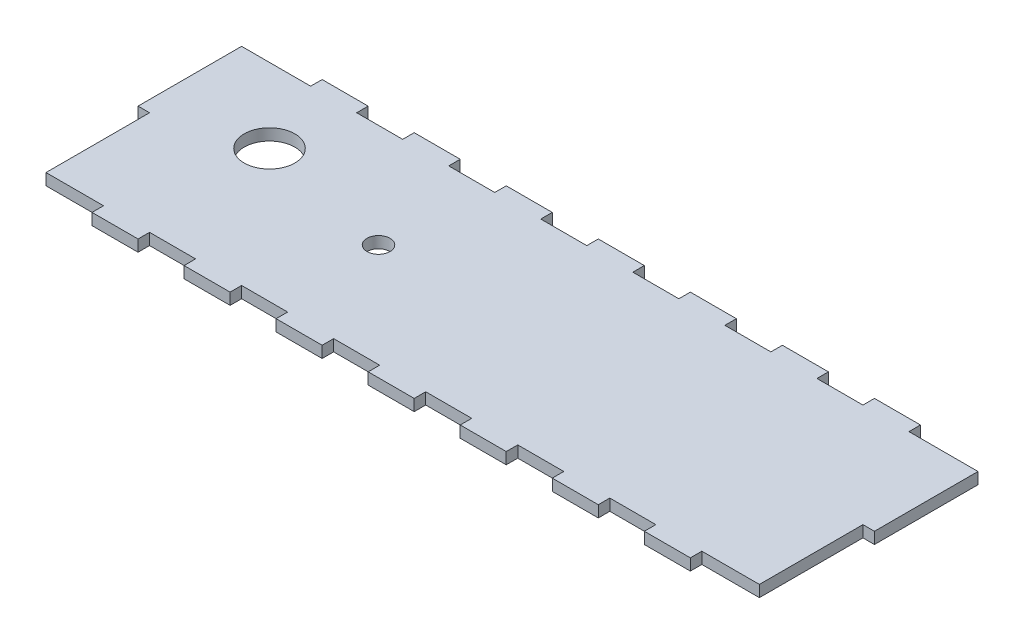
from build123d import *

# Parameters (mm, degrees)
SKETCH1_W           = 160
SKETCH1_H           = 50
BOSS_EXTRUDE1_DEPTH = 1.25
SKETCH2_W           = 10
SKETCH2_H           = 2.5
SKETCH2_W_2         = 15
CUT_EXTRUDE1_DEPTH  = 4
SKETCH3_W           = 2.5
SKETCH3_H           = 22.5
CUT_EXTRUDE2_DEPTH  = 84.852549156
CUT_EXTRUDE4_REACH  = 85.853
SKETCH4_R           = 5.5
SKETCH4_R_2         = 2.5


with BuildPart() as part:
    # Sketch1 → Boss-Extrude1 (new, symmetric)
    with BuildSketch(Plane(origin=(0, 0, 0), x_dir=(1, 0, 0), z_dir=(0, 1, 0))):
        Rectangle(SKETCH1_W, SKETCH1_H)
    extrude(amount=BOSS_EXTRUDE1_DEPTH, both=True)

    # Sketch2 → Cut-Extrude1 (cut)
    with BuildSketch(Plane(origin=(0, 1.25, 0), x_dir=(1, 0, 0), z_dir=(0, 1, 0))):
        with Locations((30, 23.75)):
            Rectangle(SKETCH2_W, SKETCH2_H)
        with Locations((10, 23.75)):
            Rectangle(SKETCH2_W, SKETCH2_H)
        with Locations((10, -23.75)):
            Rectangle(SKETCH2_W, SKETCH2_H)
        with Locations((30, -23.75)):
            Rectangle(SKETCH2_W, SKETCH2_H)
        with Locations((50, 23.75)):
            Rectangle(SKETCH2_W, SKETCH2_H)
        with Locations((50, -23.75)):
            Rectangle(SKETCH2_W, SKETCH2_H)
        with Locations((-10, 23.75)):
            Rectangle(SKETCH2_W, SKETCH2_H)
        with Locations((-10, -23.75)):
            Rectangle(SKETCH2_W, SKETCH2_H)
        with Locations((-30, 23.75)):
            Rectangle(SKETCH2_W, SKETCH2_H)
        with Locations((-30, -23.75)):
            Rectangle(SKETCH2_W, SKETCH2_H)
        with Locations((-50, 23.75)):
            Rectangle(SKETCH2_W, SKETCH2_H)
        with Locations((-50, -23.75)):
            Rectangle(SKETCH2_W, SKETCH2_H)
        with Locations((72.5, 23.75)):
            Rectangle(SKETCH2_W_2, SKETCH2_H)
        with Locations((72.5, -23.75)):
            Rectangle(SKETCH2_W_2, SKETCH2_H)
        with Locations((-72.5, 23.75)):
            Rectangle(SKETCH2_W_2, SKETCH2_H)
        with Locations((-72.5, -23.75)):
            Rectangle(SKETCH2_W_2, SKETCH2_H)
    extrude(amount=-CUT_EXTRUDE1_DEPTH, mode=Mode.SUBTRACT)

    # Sketch3 → Cut-Extrude2 (cut, through all)
    with BuildSketch(Plane(origin=(0, 1.25, 0), x_dir=(1, 0, 0), z_dir=(0, 1, 0))):
        with Locations((78.75, -11.25)):
            Rectangle(SKETCH3_W, SKETCH3_H)
        with Locations((-78.75, -11.25)):
            Rectangle(SKETCH3_W, SKETCH3_H)
    extrude(amount=-CUT_EXTRUDE2_DEPTH, mode=Mode.SUBTRACT)

    # Sketch4 → Cut-Extrude4 (cut, up to next)
    with BuildSketch(Plane.XZ.offset(1.25), mode=Mode.PRIVATE) as cut_extrude4_sk1:
        with Locations(Location((-57.7529076, -6.3187203, 0), (0, 0, 270))):
            Circle(SKETCH4_R)
    cut_extrude4_tool1 = extrude(cut_extrude4_sk1.sketch, amount=-CUT_EXTRUDE4_REACH, mode=Mode.PRIVATE) & part.part
    # Sketch4 → Cut-Extrude4 (cut, up to next)
    with BuildSketch(Plane.XZ.offset(1.25), mode=Mode.PRIVATE) as cut_extrude4_sk2:
        with Locations(Location((-27.7529076, 0, 0), (0, 0, 270))):
            Circle(SKETCH4_R_2)
    cut_extrude4_tool2 = extrude(cut_extrude4_sk2.sketch, amount=-CUT_EXTRUDE4_REACH, mode=Mode.PRIVATE) & part.part
    add(cut_extrude4_tool1.solids().sort_by_distance((-57.752908, -1.25, -6.31872))[0], mode=Mode.SUBTRACT)
    add(cut_extrude4_tool2.solids().sort_by_distance((-27.752908, -1.25, 0))[0], mode=Mode.SUBTRACT)


solid = part.part
